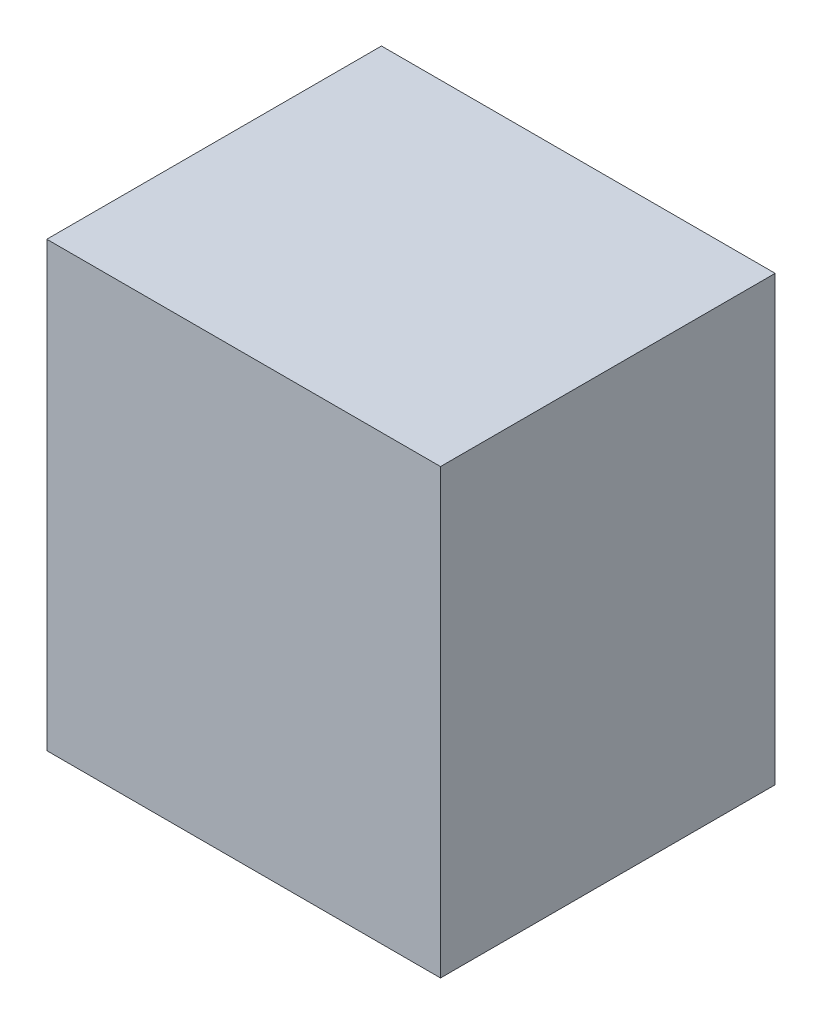
from build123d import *

# Parameters (mm, degrees)
SKETCH1_W           = 80
SKETCH1_H           = 90
BOSS_EXTRUDE1_DEPTH = 68


with BuildPart() as part:
    # Sketch1 → Boss-Extrude1 (new body)
    with BuildSketch(Plane.XY):
        Rectangle(SKETCH1_W, SKETCH1_H)
    extrude(amount=BOSS_EXTRUDE1_DEPTH)


solid = part.part
